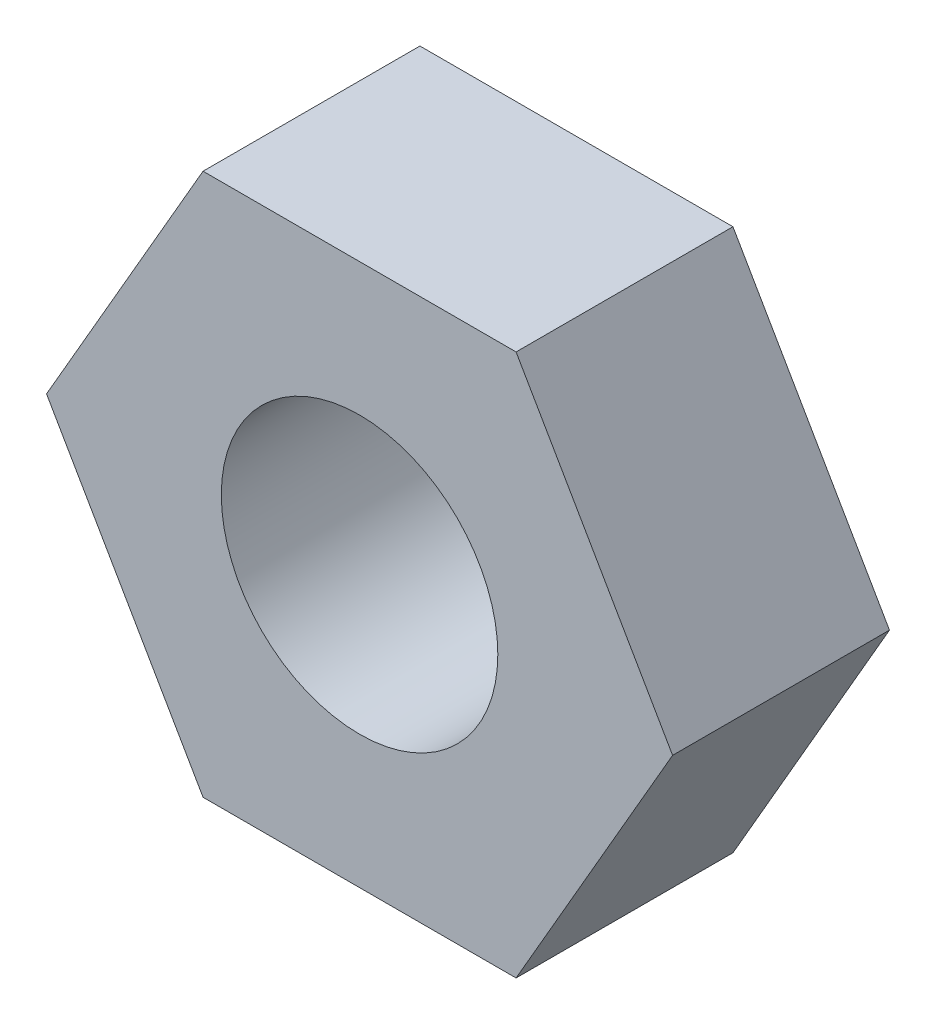
from build123d import *

# Parameters (mm, degrees)
HEX_BLANK_DEPTH                  = 1.6
NOMINAL_THREAD_ENVELOPE_START    = -1
SKETCH_NOMINAL_THREAD_ENVELOPE_R = 1.02
NOMINAL_THREAD_ENVELOPE_DEPTH    = 3.6


with BuildPart() as part:
    # Sketch_Hex_blank → Hex_blank (new body)
    with BuildSketch(Plane.XY):
        Polygon((2.309401077, 0), (1.154700538, 2), (-1.154700538, 2), (-2.309401077, 0), (-1.154700538, -2), (1.154700538, -2), align=None)
    extrude(amount=HEX_BLANK_DEPTH)

    # Sketch_Nominal_thread_envelope → Nominal_thread_envelope (cut)
    with BuildSketch(Plane.XY.offset(NOMINAL_THREAD_ENVELOPE_START)):
        Circle(SKETCH_NOMINAL_THREAD_ENVELOPE_R)
    extrude(amount=NOMINAL_THREAD_ENVELOPE_DEPTH, mode=Mode.SUBTRACT)


solid = part.part
